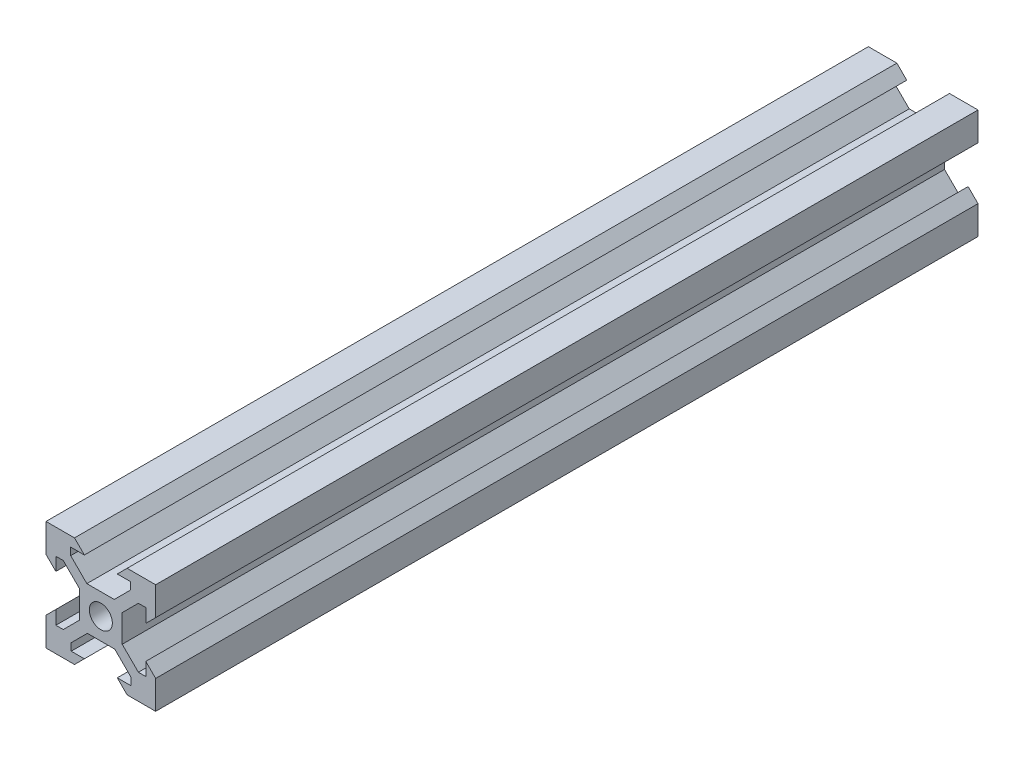
from build123d import *

# Parameters (mm, degrees)
CROQUIS1_R              = 2.1
SALIENTE_EXTRUIR1_DEPTH = 150


with BuildPart() as part:
    # Croquis1 → Saliente-Extruir1 (new body)
    with BuildSketch(Plane.XY):
        Polygon((3, 8.2), (5.4, 8.2), (5.4, 6.85), (2.45, 3.9), (-2.55, 3.9), (-5.5, 6.85), (-5.5, 8.2), (-3, 8.2), (-4.8, 10), (-10, 10), (-10, 4.8), (-8.2, 3), (-8.2, 5.4), (-6.85, 5.4), (-3.9, 2.45), (-3.9, -2.55), (-6.85, -5.5), (-8.2, -5.5), (-8.2, -3), (-10, -4.8), (-10, -10), (-4.8, -10), (-3, -8.2), (-5.4, -8.2), (-5.4, -6.85), (-2.45, -3.9), (2.55, -3.9), (5.5, -6.85), (5.5, -8.2), (3, -8.2), (4.8, -10), (10, -10), (10, -4.8), (8.2, -3), (8.2, -5.4), (6.85, -5.4), (3.9, -2.45), (3.9, 2.55), (6.85, 5.5), (8.2, 5.5), (8.2, 3), (10, 4.8), (10, 10), (4.8, 10), align=None)
        Circle(CROQUIS1_R, mode=Mode.SUBTRACT)
    extrude(amount=SALIENTE_EXTRUIR1_DEPTH)


solid = part.part
